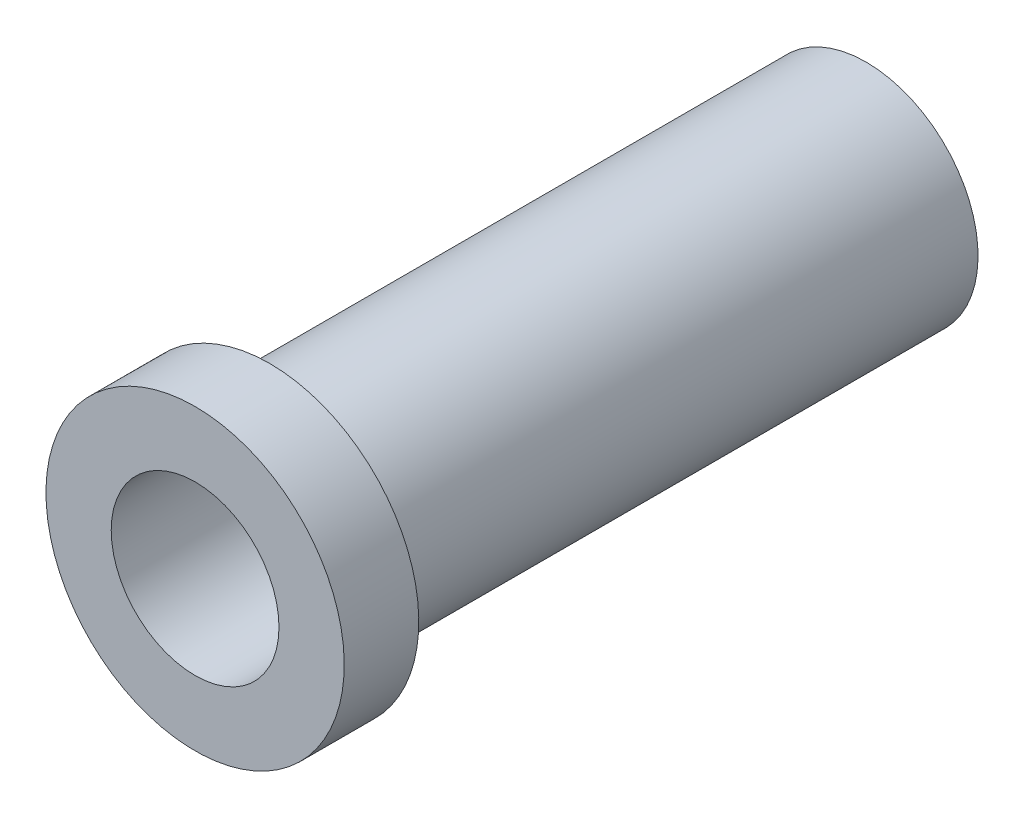
from build123d import *

# Parameters (mm, degrees)
SKETCH3_R          = 14.2875
CUT_EXTRUDE1_DEPTH = 127


with BuildPart() as part:
    # Sketch2 → Revolve1 (revolve)
    with BuildSketch(Plane(origin=(0, 0, 0), x_dir=(0, 0, -1), z_dir=(1, 0, 0)), mode=Mode.PRIVATE) as revolve1_sk:
        Polygon((57.15, 0), (-57.15, 0), (-57.15, -25.4), (-44.45, -25.4), (-44.45, -19.05), (57.15, -19.05), align=None)
    revolve(revolve1_sk.sketch.rotate(Axis((0, 0, -57.15), (0, 0, 1)), 180), axis=Axis((0, 0, -57.15), (0, 0, 1)))

    # Sketch3 → Cut-Extrude1 (cut)
    with BuildSketch(Plane.XY.offset(57.15)):
        Circle(SKETCH3_R)
    extrude(amount=-CUT_EXTRUDE1_DEPTH, mode=Mode.SUBTRACT)


solid = part.part
